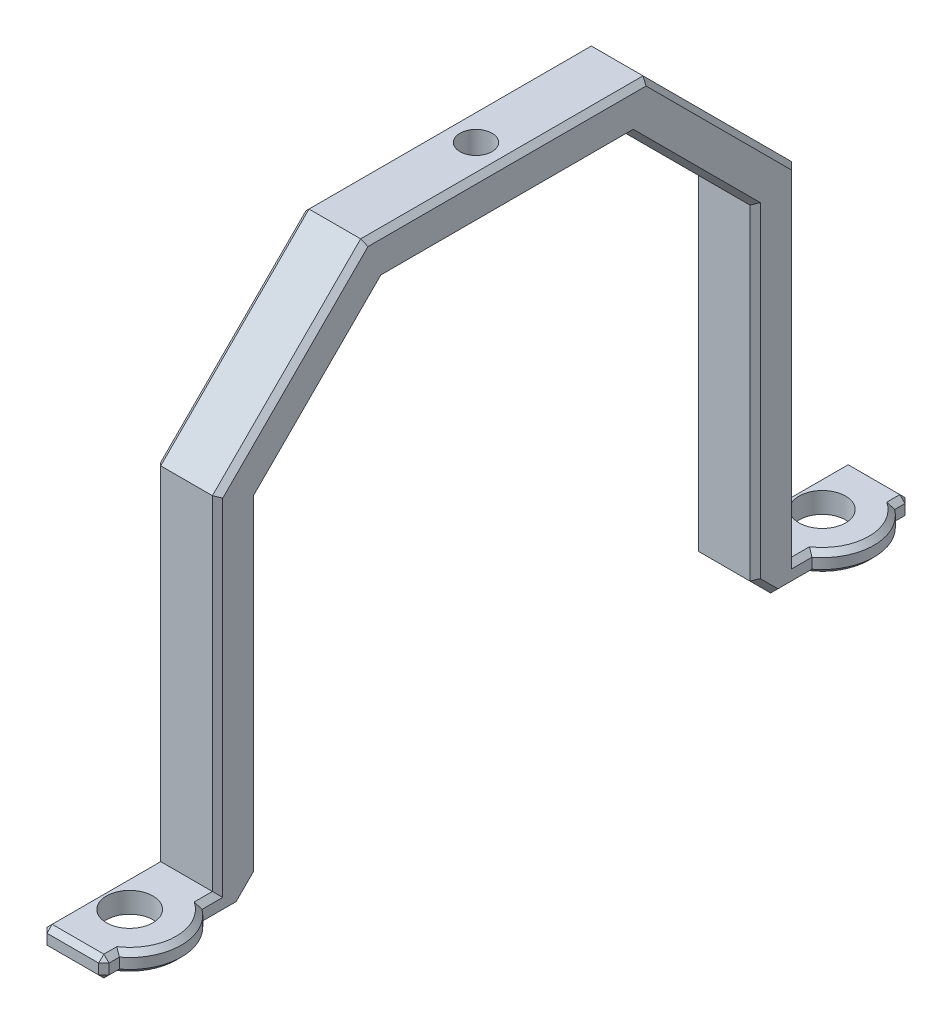
from build123d import *

# Parameters (mm, degrees)
SKETCH1_W           = 6
SKETCH1_H           = 24
SKETCH1_R           = 1.55
BOSS_EXTRUDE1_DEPTH = 4
BOSS_EXTRUDE2_DEPTH = 6
SKETCH3_R           = 2.25
CUT_EXTRUDE1_DEPTH  = 62.532511732
BOSS_EXTRUDE3_DEPTH = 2
CHAMFER1_SIZE       = 0.5


with BuildPart() as part:
    # Sketch1 → Boss-Extrude1 (new body)
    with BuildSketch(Plane(origin=(0, 0, 0), x_dir=(1, 0, 0), z_dir=(0, 1, 0))):
        Rectangle(SKETCH1_W, SKETCH1_H)
        with Locations(Location((0, 0, 0), (0, 0, 270))):
            Circle(SKETCH1_R, mode=Mode.SUBTRACT)
    extrude(amount=BOSS_EXTRUDE1_DEPTH)

    # Sketch2 → Boss-Extrude2 (add)
    with BuildSketch(Plane.ZY.offset(3)):
        Polygon((-12, 0), (-24, -12), (-24, -43.5), (-26, -45.5), (-39, -45.5), (-39, -43.5), (-28, -43.5), (-28, -10.343145751), (-13.656854249, 4), (-12, 4), align=None)
    boss_extrude2 = extrude(amount=-BOSS_EXTRUDE2_DEPTH)

    # Sketch3 → Cut-Extrude1 (cut, through all)
    with BuildSketch(Plane(origin=(0, -43.5, 0), x_dir=(1, 0, 0), z_dir=(0, 1, 0))):
        with Locations(Location((0, 33.5, 0), (0, 0, 270))):
            Circle(SKETCH3_R)
    cut_extrude1 = extrude(amount=-CUT_EXTRUDE1_DEPTH, mode=Mode.SUBTRACT)

    # Sketch4 → Boss-Extrude3 (add)
    with BuildSketch(Plane(origin=(0, -43.5, 0), x_dir=(1, 0, 0), z_dir=(0, 1, 0))):
        with BuildLine():
            Line((3, 29.5), (3, 37.5))
            ThreePointArc((3, 37.5), (5, 33.5), (3, 29.5))
        make_face()
    boss_extrude3 = extrude(amount=-BOSS_EXTRUDE3_DEPTH)

    # Mirror1: Boss-Extrude2, Cut-Extrude1, Boss-Extrude3 across plane
    add(boss_extrude2.mirror(Plane.XY))
    add(cut_extrude1.mirror(Plane.XY), mode=Mode.SUBTRACT)
    add(boss_extrude3.mirror(Plane.XY))

    # Chamfer1
    chamfer1_edges = [part.edges().sort_by_distance(p)[0] for p in [
        (-3, 4, 0),
        (0, -45.5, -39),
        (0, -43.5, -39),
        (-3, -3.171572875, -20.828427125),
        (-3, -26.921572875, -28),
        (-3, -43.5, -33.5),
        (-3, -44.5, -39),
        (-3, -45.5, -32.5),
        (-3, -44.5, -25),
        (-3, -27.75, -24),
        (-3, -6, -18),
        (3, -6, -18),
        (3, -27.75, -24),
        (3, -44.5, -25),
        (3, -45.5, -27.75),
        (3, -44.5, -39),
        (3, -43.5, -38.25),
        (3, -26.921572875, -28),
        (3, -3.171572875, -20.828427125),
        (3, -43.5, -28.75),
        (3, -45.5, -38.25),
        (5, -43.5, -33.5),
        (5, -45.5, -33.5),
        (3, 4, 0),
        (-3, 0, 0),
        (3, -6, 18),
        (-3, -6, 18),
        (3, -27.75, 24),
        (-3, -27.75, 24),
        (3, -44.5, 25),
        (-3, -44.5, 25),
        (3, -45.5, 27.75),
        (0, -45.5, 39),
        (-3, -45.5, 32.5),
        (3, -44.5, 39),
        (0, -43.5, 39),
        (-3, -44.5, 39),
        (3, -43.5, 38.25),
        (-3, -43.5, 33.5),
        (3, -26.921572875, 28),
        (-3, -26.921572875, 28),
        (3, -3.171572875, 20.828427125),
        (-3, -3.171572875, 20.828427125),
        (3, 0, 0),
        (3, -43.5, 28.75),
        (3, -45.5, 38.25),
        (5, -43.5, 33.5),
        (5, -45.5, 33.5),
    ]]
    chamfer(chamfer1_edges, length=CHAMFER1_SIZE)


solid = part.part
